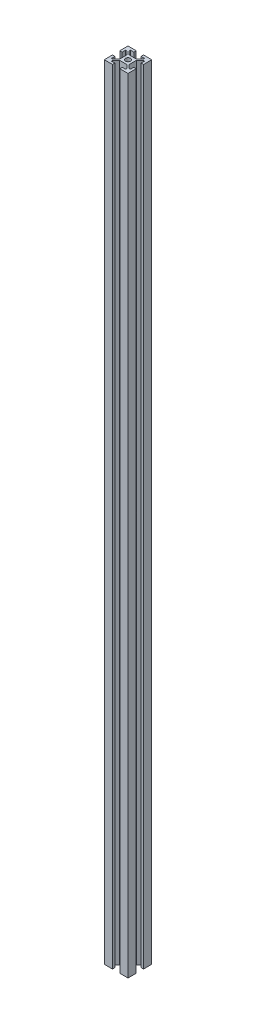
from build123d import *

# Parameters (mm, degrees)
SKETCH_1_R          = 2.15
EXTRUDE_1_DEPTH     = 659.8
SKETCH_3_R          = 3
CUT_EXTRUDE_1_DEPTH = 26


with BuildPart() as part:
    # 스케치1 → 보스-돌출1 (new body)
    with BuildSketch(Plane(origin=(0, 0, 0), x_dir=(1, 0, 0), z_dir=(0, 1, 0))):
        Polygon((3.1, 8), (6, 8), (6, 7), (3, 4), (0, 4), (-3, 4), (-6, 7), (-6, 8), (-3.1, 8), (-3.1, 9.998992087), (-10.001007855, 9.998992087), (-10.001007855, 3.1), (-8, 3.1), (-8, 6), (-7, 6), (-4, 3), (-4, 0), (-4, -3), (-7, -6), (-8, -6), (-8, -3.1), (-10.001007855, -3.1), (-10.001007855, -9.998992087), (-3.1, -9.998992087), (-3.1, -8), (-6, -8), (-6, -7), (-3, -4), (0, -4), (3, -4), (6, -7), (6, -8), (3.1, -8), (3.1, -9.998992087), (10.001007855, -9.998992087), (10.001007855, -3.1), (8, -3.1), (8, -6), (7, -6), (4, -3), (4, 0), (4, 3), (7, 6), (8, 6), (8, 3.1), (10.001007855, 3.1), (10.001007855, 9.998992087), (3.1, 9.998992087), align=None)
        with Locations(Location((0, 0, 0), (0, 0, 90))):
            Circle(SKETCH_1_R, mode=Mode.SUBTRACT)
    extrude(amount=EXTRUDE_1_DEPTH)

    # 스케치3 → 컷-돌출1 (cut)
    with BuildSketch(Plane(origin=(10.001007855, 0, 0), x_dir=(0, 0, -1), z_dir=(1, 0, 0))):
        with Locations((0, 329.9)):
            Circle(SKETCH_3_R)
    extrude(amount=-CUT_EXTRUDE_1_DEPTH, mode=Mode.SUBTRACT)


solid = part.part
